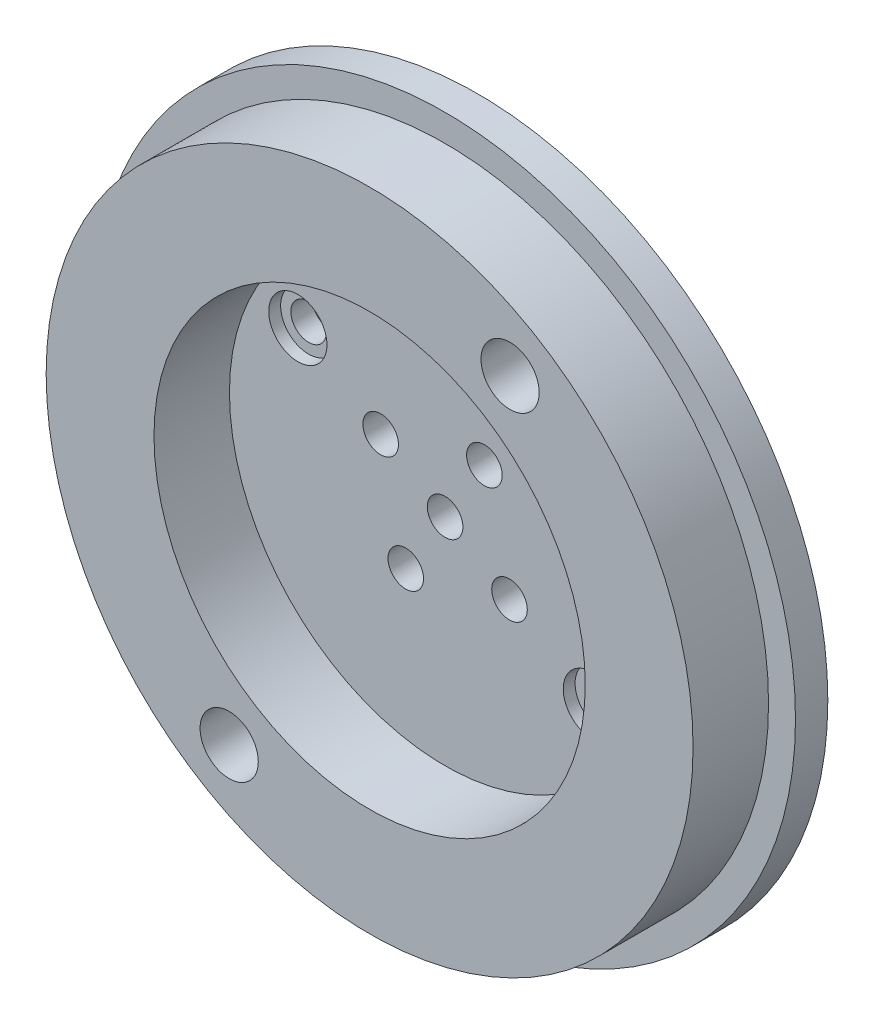
from build123d import *

# Parameters (mm, degrees)
SKETCH_1_R          = 32.5
EXTRUDE_1_DEPTH     = 3
SKETCH_2_R          = 30
EXTRUDE_2_DEPTH     = 7
SKETCH_3_R          = 20
CUT_EXTRUDE_2_DEPTH = 7
SKETCH_4_R          = 2.7
CUT_EXTRUDE_3_DEPTH = 10
SKETCH_5_R          = 2.6
SKETCH_5_R_2        = 1.65
EXTRUDE_3_DEPTH     = 2
EXTRUDE_3_2_DEPTH   = 2
EXTRUDE_3_3_DEPTH   = 2
EXTRUDE_3_4_DEPTH   = 2
SKETCH_6_R          = 1.65
CUT_EXTRUDE_4_DEPTH = 10


with BuildPart() as part:
    # 草图1 → 凸台-拉伸1 (new body)
    with BuildSketch(Plane.XY):
        Circle(SKETCH_1_R)
    extrude(amount=EXTRUDE_1_DEPTH)

    # 草图2 → 凸台-拉伸2 (add)
    with BuildSketch(Plane.XY.offset(3)):
        Circle(SKETCH_2_R)
    extrude(amount=EXTRUDE_2_DEPTH)

    # 草图3 → 切除-拉伸2 (cut)
    with BuildSketch(Plane.XY.offset(10)):
        Circle(SKETCH_3_R)
    extrude(amount=-CUT_EXTRUDE_2_DEPTH, mode=Mode.SUBTRACT)

    # 草图4 → 切除-拉伸3 (cut)
    with BuildSketch(Plane.XY.offset(10)):
        with Locations((-13.025575957, -21.336163787)):
            Circle(SKETCH_4_R)
        with Locations((13.025575957, 21.336163787)):
            Circle(SKETCH_4_R)
        with Locations((13.656264529, -8.337052184)):
            Circle(SKETCH_4_R)
        with Locations((-13.656264529, 8.337052184)):
            Circle(SKETCH_4_R)
    extrude(amount=-CUT_EXTRUDE_3_DEPTH, mode=Mode.SUBTRACT)

    # 草图6 → 切除-拉伸4 (cut)
    with BuildSketch(Plane(origin=(0, 0, 0), x_dir=(-1, 0, 0), z_dir=(0, 0, -1))):
        Circle(SKETCH_6_R)
        with Locations((5.974615731, 3.647460331)):
            Circle(SKETCH_6_R)
        with Locations((3.647460331, -5.974615731)):
            Circle(SKETCH_6_R)
        with Locations((-5.974615731, -3.647460331)):
            Circle(SKETCH_6_R)
        with Locations((-3.647460331, 5.974615731)):
            Circle(SKETCH_6_R)
    extrude(amount=-CUT_EXTRUDE_4_DEPTH, mode=Mode.SUBTRACT)


with BuildPart() as body_2:
    # 草图5 → 凸台-拉伸3 (new body)
    with BuildSketch(Plane(origin=(0, 0, 0), x_dir=(-1, 0, 0), z_dir=(0, 0, -1))):
        with Locations((13.025575957, -21.336163787)):
            Circle(SKETCH_5_R)
        with Locations((13.025575957, -21.336163787)):
            Circle(SKETCH_5_R_2, mode=Mode.SUBTRACT)
    extrude(amount=-EXTRUDE_3_DEPTH)


with BuildPart() as body_3:
    # 草图5 → Extrude 3 2 (new body)
    with BuildSketch(Plane(origin=(0, 0, 0), x_dir=(-1, 0, 0), z_dir=(0, 0, -1))):
        with Locations((-13.025575957, 21.336163787)):
            Circle(SKETCH_5_R)
        with Locations((-13.025575957, 21.336163787)):
            Circle(SKETCH_5_R_2, mode=Mode.SUBTRACT)
    extrude(amount=-EXTRUDE_3_2_DEPTH)


with BuildPart() as body_4:
    # 草图5 → Extrude 3 3 (new body)
    with BuildSketch(Plane(origin=(0, 0, 0), x_dir=(-1, 0, 0), z_dir=(0, 0, -1))):
        with Locations((-13.656264529, -8.337052184)):
            Circle(SKETCH_5_R)
        with Locations((-13.656264529, -8.337052184)):
            Circle(SKETCH_5_R_2, mode=Mode.SUBTRACT)
    extrude(amount=-EXTRUDE_3_3_DEPTH)


with BuildPart() as body_5:
    # 草图5 → Extrude 3 4 (new body)
    with BuildSketch(Plane(origin=(0, 0, 0), x_dir=(-1, 0, 0), z_dir=(0, 0, -1))):
        with Locations((13.656264529, 8.337052184)):
            Circle(SKETCH_5_R)
        with Locations((13.656264529, 8.337052184)):
            Circle(SKETCH_5_R_2, mode=Mode.SUBTRACT)
    extrude(amount=-EXTRUDE_3_4_DEPTH)


solid = Compound([part.part, body_2.part, body_3.part, body_4.part, body_5.part])
